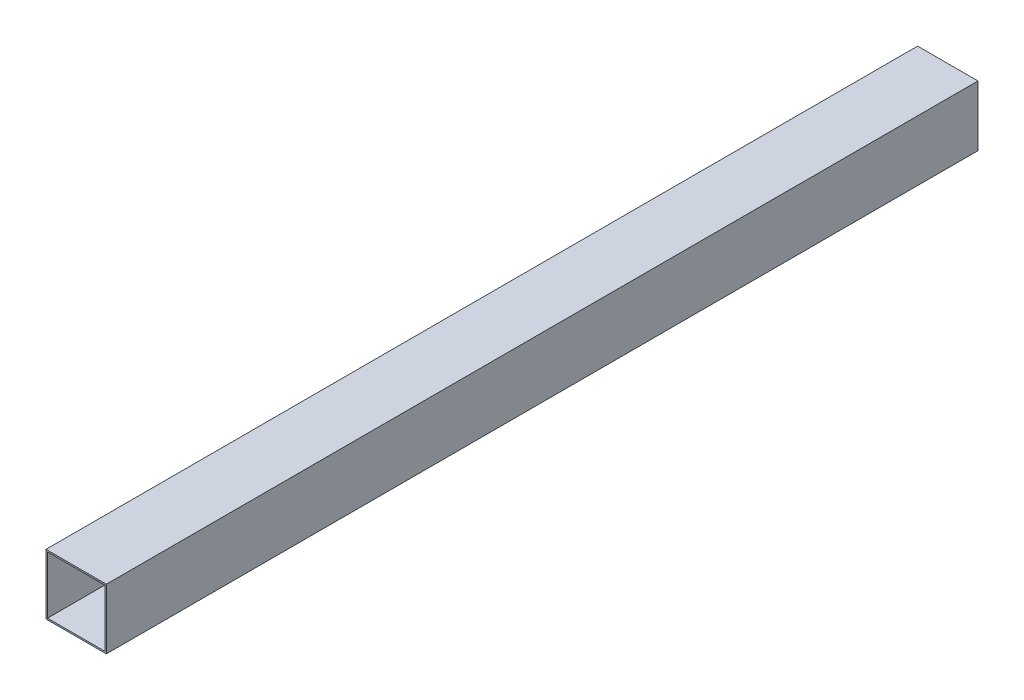
from build123d import *

# Parameters (mm, degrees)
CROQUIS1_W              = 76.2
CROQUIS1_H              = 76.2
CROQUIS1_W_2            = 72.4
CROQUIS1_H_2            = 72.4
SALIENTE_EXTRUIR1_DEPTH = 1100


with BuildPart() as part:
    # Croquis1 → Saliente-Extruir1 (new body)
    with BuildSketch(Plane.XY):
        with Locations((38.1, -38.1)):
            Rectangle(CROQUIS1_W, CROQUIS1_H)
        with Locations((38.1, -38.1)):
            Rectangle(CROQUIS1_W_2, CROQUIS1_H_2, mode=Mode.SUBTRACT)
    extrude(amount=SALIENTE_EXTRUIR1_DEPTH)


solid = part.part
